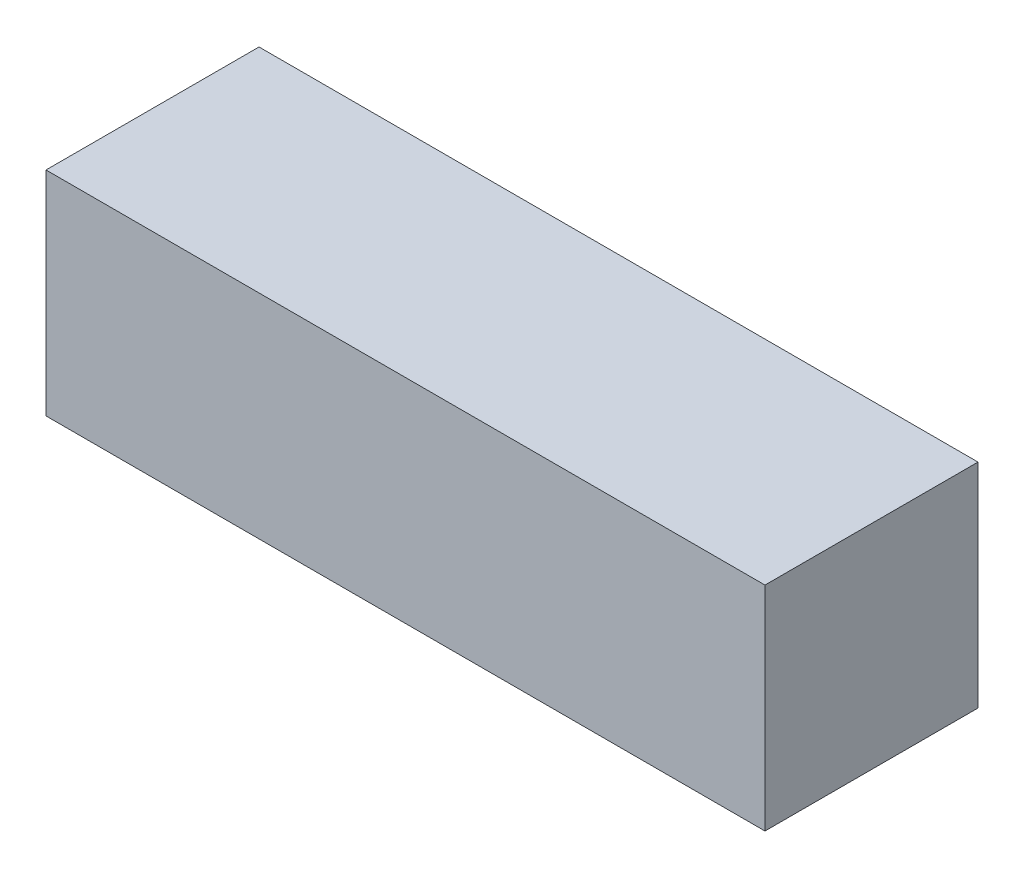
from build123d import *

# Parameters (mm, degrees)
SKETCH1_W           = 171.45
SKETCH1_H           = 50.8
BOSS_EXTRUDE1_DEPTH = 50.8


with BuildPart() as part:
    # Sketch1 → Boss-Extrude1 (new body)
    with BuildSketch(Plane.XY):
        Rectangle(SKETCH1_W, SKETCH1_H)
    extrude(amount=BOSS_EXTRUDE1_DEPTH)


solid = part.part
